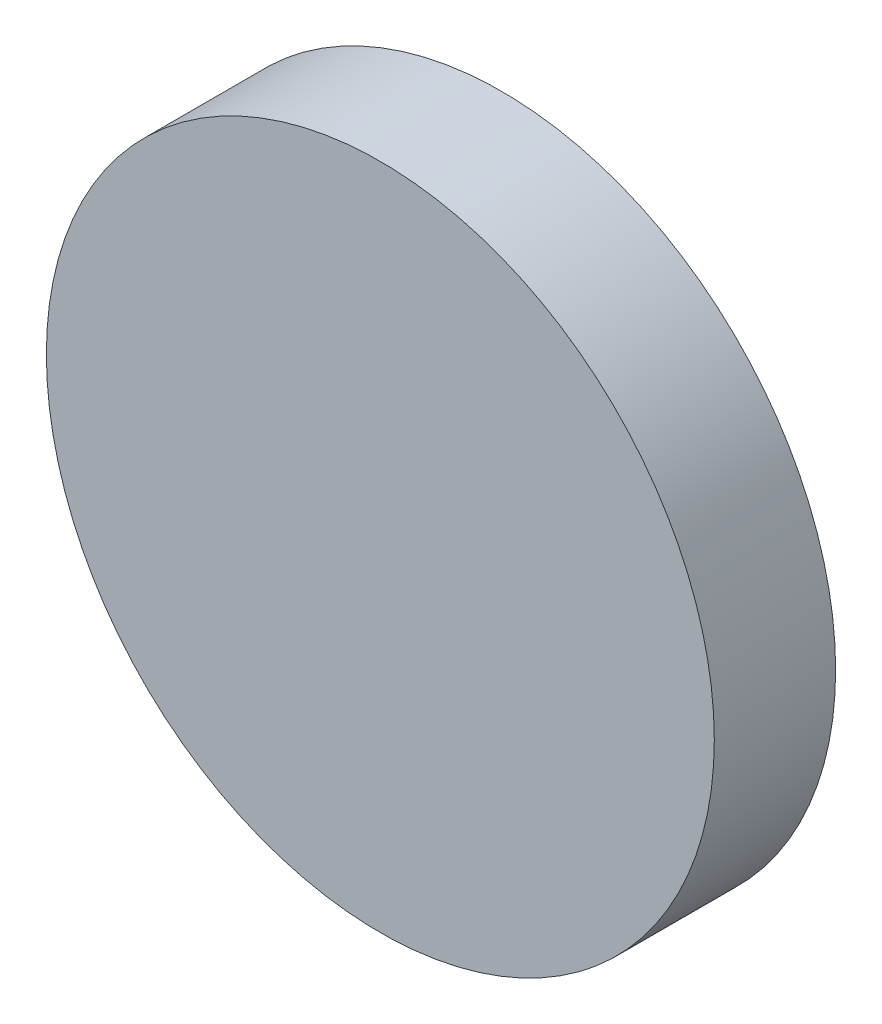
from build123d import *

# Parameters (mm, degrees)
SKETCH_1_R      = 27.526986335
EXTRUDE_1_DEPTH = 10


with BuildPart() as part:
    # 草图1 → 凸台-拉伸1 (new body)
    with BuildSketch(Plane.XY):
        Circle(SKETCH_1_R)
    extrude(amount=EXTRUDE_1_DEPTH)


solid = part.part
